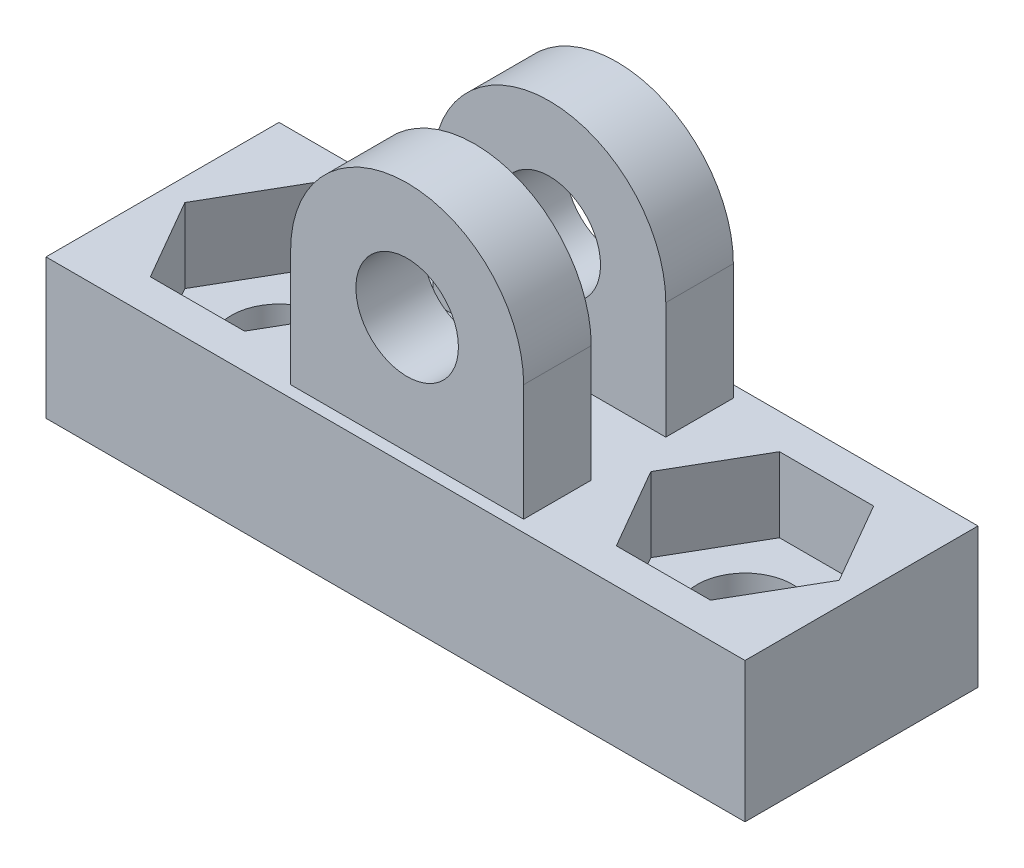
from build123d import *

# Parameters (mm, degrees)
SKETCH1_W           = 10
SKETCH1_H           = 10
SKETCH1_R           = 2.05
BOSS_EXTRUDE1_DEPTH = 6
CUT_EXTRUDE1_DEPTH  = 3.2
SKETCH3_W           = 10
SKETCH3_H           = 6
BOSS_EXTRUDE2_DEPTH = 20
SKETCH4_R           = 2.05
CUT_EXTRUDE2_DEPTH  = 27.191601707
CUT_EXTRUDE3_DEPTH  = 3.2
SKETCH8_R           = 2.2
BOSS_EXTRUDE4_DEPTH = 4.5
SKETCH10_W          = 17.254554438
SKETCH10_H          = 12.252832867
CUT_EXTRUDE5_DEPTH  = 1.6


with BuildPart() as part:
    # Sketch1 → Boss-Extrude1 (new body)
    with BuildSketch(Plane(origin=(0, 0, 0), x_dir=(1, 0, 0), z_dir=(0, 1, 0))):
        Rectangle(SKETCH1_W, SKETCH1_H)
        with Locations(Location((0, 0, 0), (0, 0, 270))):
            Circle(SKETCH1_R, mode=Mode.SUBTRACT)
    extrude(amount=BOSS_EXTRUDE1_DEPTH)

    # Sketch2 → Cut-Extrude1 (cut)
    with BuildSketch(Plane(origin=(0, 6, 0), x_dir=(1, 0, 0), z_dir=(0, 1, 0))):
        Polygon((4.041451884, 0), (2.020725942, 3.5), (-2.020725942, 3.5), (-4.041451884, 0), (-2.020725942, -3.5), (2.020725942, -3.5), align=None)
    extrude(amount=-CUT_EXTRUDE1_DEPTH, mode=Mode.SUBTRACT)

    # Sketch3 → Boss-Extrude2 (add)
    with BuildSketch(Plane(origin=(5, 0, 0), x_dir=(0, 0, -1), z_dir=(1, 0, 0))):
        with Locations((0, 3)):
            Rectangle(SKETCH3_W, SKETCH3_H)
    extrude(amount=BOSS_EXTRUDE2_DEPTH)

    # Sketch4 → Cut-Extrude2 (cut, through all)
    with BuildSketch(Plane(origin=(0, 6, 0), x_dir=(1, 0, 0), z_dir=(0, 1, 0))):
        with Locations(Location((20, 0, 0), (0, 0, 270))):
            Circle(SKETCH4_R)
    extrude(amount=-CUT_EXTRUDE2_DEPTH, mode=Mode.SUBTRACT)

    # Sketch5 → Cut-Extrude3 (cut)
    with BuildSketch(Plane(origin=(0, 6, 0), x_dir=(1, 0, 0), z_dir=(0, 1, 0))):
        Polygon((24.041451884, 0), (22.020725942, 3.5), (17.979274058, 3.5), (15.958548116, 0), (17.979274058, -3.5), (22.020725942, -3.5), align=None)
    extrude(amount=-CUT_EXTRUDE3_DEPTH, mode=Mode.SUBTRACT)

    # Sketch8 → Boss-Extrude4 (add, symmetric)
    with BuildSketch(Plane.XY):
        with BuildLine():
            Line((5, 6), (5, 11))
            ThreePointArc((5, 11), (10, 16), (15, 11))
            Line((15, 11), (15, 6))
            Line((15, 6), (5, 6))
        make_face()
        with Locations((10, 11)):
            Circle(SKETCH8_R, mode=Mode.SUBTRACT)
    extrude(amount=BOSS_EXTRUDE4_DEPTH, both=True)

    # Sketch10 → Cut-Extrude5 (cut, symmetric)
    with BuildSketch(Plane.XY):
        with Locations((11.441920225, 12.126416434)):
            Rectangle(SKETCH10_W, SKETCH10_H)
    extrude(amount=CUT_EXTRUDE5_DEPTH, both=True, mode=Mode.SUBTRACT)


solid = part.part
